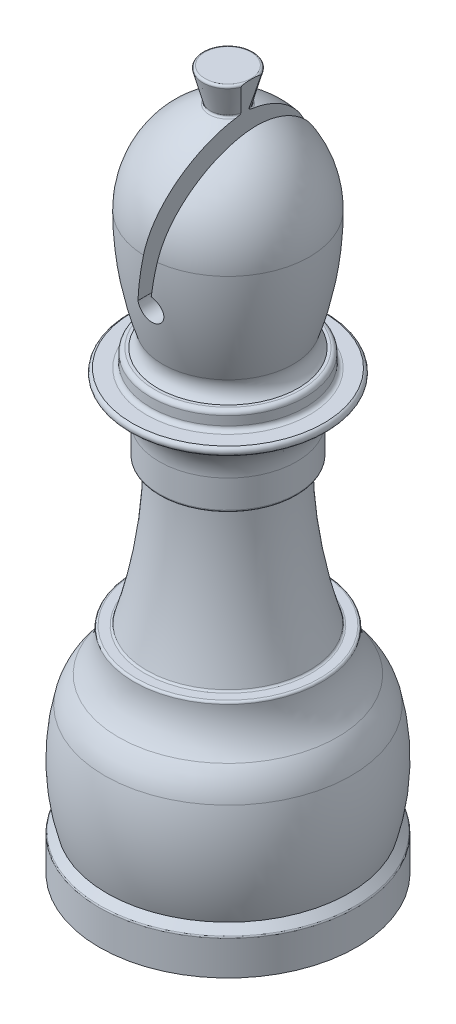
from build123d import *

# Parameters (mm, degrees)
CUT_EXTRUDE1_DEPTH      = 85.215497519
CUT_EXTRUDE1_DEPTH_BACK = 85.215497519
SCALE1_SCALE            = 0.766666667
CUT_EXTRUDE2_DEPTH      = 65.565214795
CUT_EXTRUDE2_DEPTH_BACK = 11
SKETCH3_R               = 10.2
SKETCH6_W               = 10.75
SKETCH6_H               = 1


with BuildPart() as part:
    # Sketch1 → Revolve1 (revolve)
    with BuildSketch(Plane.XY, mode=Mode.PRIVATE) as revolve1_sk:
        with BuildLine():
            Line((0, 81.5), (-2.674193657, 81.5))
            ThreePointArc((-2.674193657, 81.5), (-2.872531992, 81.402190357), (-2.915675113, 81.185295239))
            Line((-2.915675113, 81.185295239), (-2.039838083, 77.916626942))
            ThreePointArc((-2.039838083, 77.916626942), (-2.058203911, 77.739141791), (-2.190227634, 77.619108382))
            ThreePointArc((-2.190227634, 77.619108382), (-7.498358221, 73.392820344), (-9.5, 66.909673646))
            ThreePointArc((-9.5, 66.909673646), (-9.022273487, 60.942994015), (-7.601265823, 55.128337906))
            ThreePointArc((-7.601265823, 55.128337906), (-7.569417538, 53.977648242), (-8.177123449, 53.00000079))
            Line((-8.177123449, 53.00000079), (-8.5, 53.00000079))
            ThreePointArc((-8.5, 53.00000079), (-8.853553391, 52.85355418), (-9, 52.50000079))
            Line((-9, 52.50000079), (-9, 51.469798658))
            ThreePointArc((-9, 51.469798658), (-9.146446609, 51.116245267), (-9.5, 50.969798658))
            Line((-9.5, 50.969798658), (-11.17114094, 50.969798658))
            ThreePointArc((-11.17114094, 50.969798658), (-11.5, 50.5), (-11.17114094, 50.030201342))
            ThreePointArc((-11.17114094, 50.030201342), (-8.871560383, 48.264907732), (-8, 45.5))
            Line((-8, 45.5), (-8, 42.25))
            ThreePointArc((-8, 42.25), (-7.926776695, 42.073223305), (-7.75, 42))
            Line((-7.75, 42), (-7.25, 42))
            ThreePointArc((-7.25, 42), (-7.072844439, 41.926397016), (-7.000002302, 41.748927259))
            ThreePointArc((-7.000002302, 41.748927259), (-7.638690703, 33.374674773), (-9.469707161, 25.178126334))
            ThreePointArc((-9.469707161, 25.178126334), (-9.559935457, 25.049415334), (-9.709152721, 25))
            Line((-9.709152721, 25), (-10.709152721, 25))
            ThreePointArc((-10.709152721, 25), (-10.885929416, 24.926776695), (-10.959152721, 24.75))
            ThreePointArc((-10.959152721, 24.75), (-11.423225699, 22.243676405), (-12.753912139, 20.069671969))
            ThreePointArc((-12.753912139, 20.069671969), (-13.752308854, 18.632010167), (-14.362830433, 16.991604468))
            ThreePointArc((-14.362830433, 16.991604468), (-14.994392071, 10.979343909), (-14.103553391, 5))
            Line((-14.103553391, 5), (-14.926776695, 4.176776695))
            ThreePointArc((-14.926776695, 4.176776695), (-14.980969883, 4.095670858), (-15, 4))
            Line((-15, 4), (-15, 0))
            Line((-15, 0), (0, 0))
            Line((0, 0), (0, 81.5))
        make_face()
    revolve(revolve1_sk.sketch.rotate(Axis((0, 0, 0), (0, -1, 0)), 270), axis=Axis((0, 0, 0), (0, -1, 0)))

    # Sketch2 → Cut-Extrude1 (cut, two sides: drawn at the far end of the back side and taken through both)
    with BuildSketch(Plane.XY.offset(-CUT_EXTRUDE1_DEPTH_BACK)):
        with BuildLine():
            Line((0.916437555, 65.653839061), (0.343856243, 62.960055781))
            ThreePointArc((0.343856243, 62.960055781), (0.931186242, 60.324035637), (-1.5, 61.5))
            Line((-1.5, 61.5), (-0.590117131, 65.780662339))
            Line((-0.590117131, 65.780662339), (1.945867371, 77.711531388))
            Line((1.945867371, 77.711531388), (2.777514135, 81.624121791))
            Line((2.777514135, 81.624121791), (4.24473641, 81.312254069))
            Line((4.24473641, 81.312254069), (3.347434573, 77.09078083))
            Line((3.347434573, 77.09078083), (0.916437555, 65.653839061))
        make_face()
    extrude(amount=CUT_EXTRUDE1_DEPTH + CUT_EXTRUDE1_DEPTH_BACK, mode=Mode.SUBTRACT)


with BuildPart() as part_1:
    # Scale1: scaled about (0, 0, 0)
    add(part.part.scale(SCALE1_SCALE))

    # Sketch3 → Cut-Extrude2 (cut, two sides: drawn at the far end of the back side and taken through both)
    with BuildSketch(Plane.XZ.offset(-CUT_EXTRUDE2_DEPTH_BACK)):
        with Locations(Location((0, 0, 0), (0, 0, 90))):
            Circle(SKETCH3_R)
    extrude(amount=CUT_EXTRUDE2_DEPTH + CUT_EXTRUDE2_DEPTH_BACK, mode=Mode.SUBTRACT)

    # Sketch6 → Cut-Revolve1 (revolve, cut)
    with BuildSketch(Plane.XY, mode=Mode.PRIVATE) as cut_revolve1_sk:
        with Locations((-5.375, 0.5)):
            Rectangle(SKETCH6_W, SKETCH6_H)
    revolve(cut_revolve1_sk.sketch.rotate(Axis((0, 0, 0), (0, -1, 0)), 270), axis=Axis((0, 0, 0), (0, -1, 0)), mode=Mode.SUBTRACT)


with BuildPart() as body_2:
    # Sketch7 → Base (Black Bishop) (revolve)
    with BuildSketch(Plane.XY):
        Polygon((0, 1.004586126), (0, 3.5), (-10, 3.5), (-10, 1), (-10.55, 1), (-10.55, 0), (0, 0), align=None)
    revolve(axis=Axis((0, 0, 0), (0, -1, 0)))


solid = Compound([part_1.part, body_2.part])
